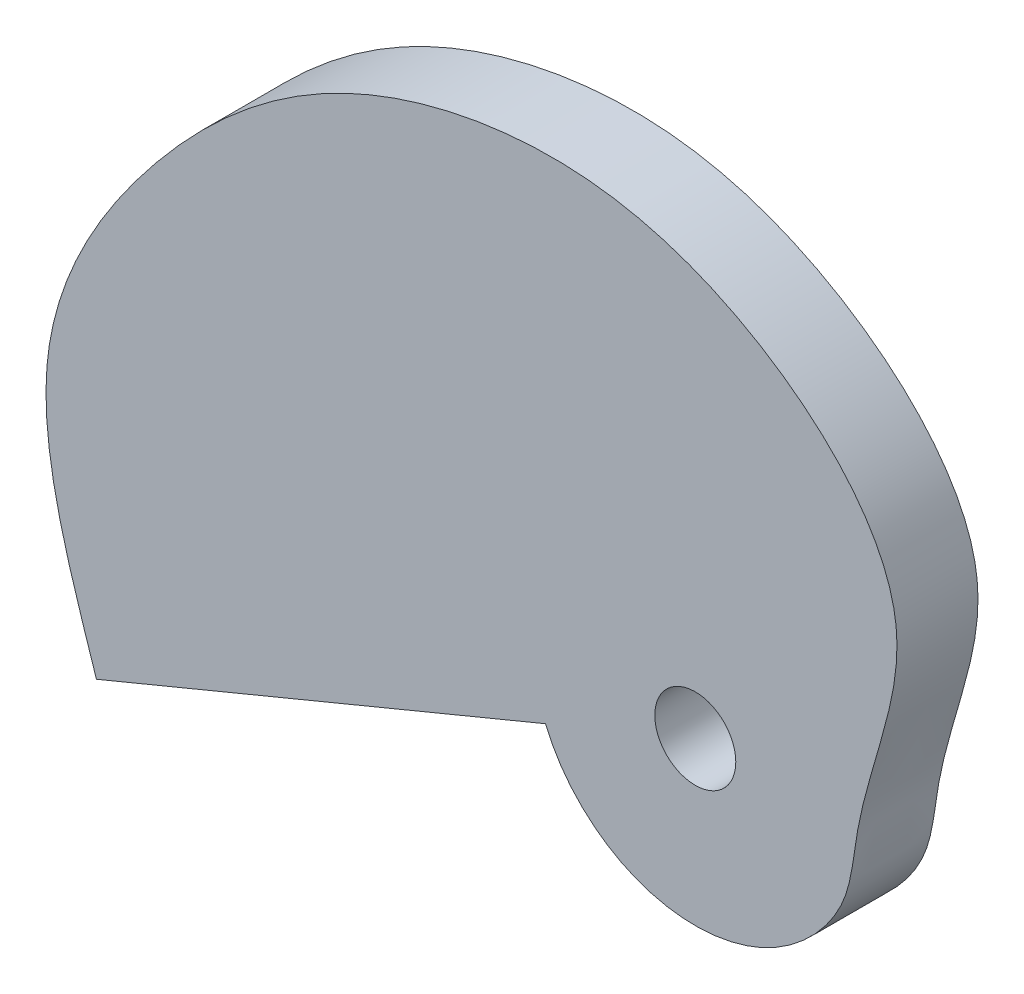
from build123d import *

# Parameters (mm, degrees)
SKETCH1_R           = 3.175
BOSS_EXTRUDE1_DEPTH = 6.35


with BuildPart() as part:
    # Sketch1 → Boss-Extrude1 (new body)
    with BuildSketch(Plane.XY):
        with BuildLine():
            Line((-11.733270063, -4.860079591), (-46.933080252, -19.440318364))
            add(Edge.make_bspline(
                [(-11.733270063, -4.860079591), (-10.487495203, -7.956994553), (-6.64935925, -11.710360551), (-0.002141621, -13.030211087), (4.996121329, -12.038832469), (9.178133853, -9.214079414), (12.172879986, -4.9863866), (12.795317649, 3.703899521), (20.137661814, 18.293493751), (2.731721861, 32.72152417), (-14.520947687, 34.713095279), (-30.431804282, 29.972134805), (-43.543919582, 17.902900125), (-53.813801552, 0.199176097), (-48.900440529, -13.417723456), (-46.933080252, -19.440318364)],
                knots=[0, 0, 0, 0, 0.061874438, 0.092811657, 0.123748876, 0.154686095, 0.185623314, 0.216560532, 0.316466099, 0.456638494, 0.544748217, 0.643879921, 0.754152557, 0.875652356, 1, 1, 1, 1], degree=3))
        make_face()
        Circle(SKETCH1_R, mode=Mode.SUBTRACT)
    extrude(amount=BOSS_EXTRUDE1_DEPTH)


solid = part.part
